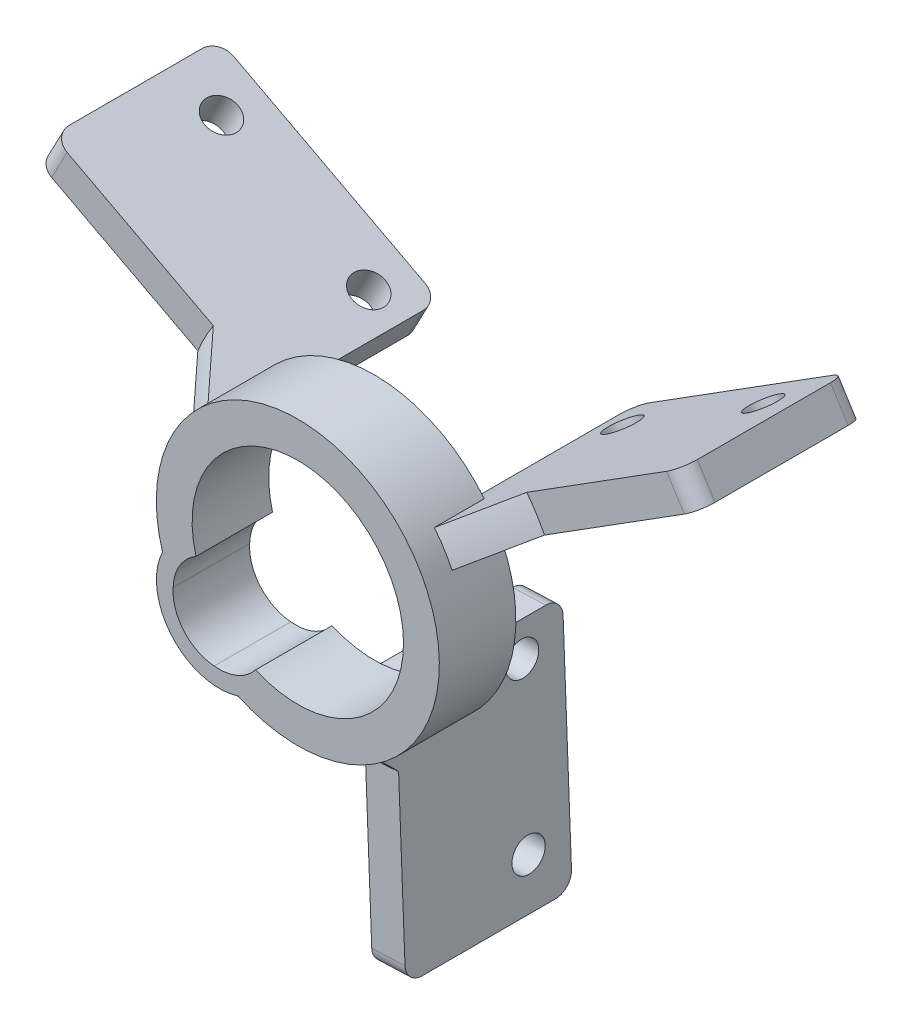
from build123d import *

# Parameters (mm, degrees)
CROQUIS1_R              = 8.5
SALIENTE_EXTRUIR1_DEPTH = 4.6
CROQUIS6_R              = 6.35
CORTAR_EXTRUIR1_DEPTH   = 13.870897405
CROQUIS13_R             = 2.775
CORTAR_EXTRUIR7_DEPTH   = 10
SALIENTE_EXTRUIR4_DEPTH = 4.6
SALIENTE_EXTRUIR6_DEPTH = 10
CHAFL_N1_SIZE           = 3
REDONDEO1_R             = 1
CROQUIS16_R             = 1
CORTAR_EXTRUIR8_DEPTH   = 5
CHAFL_N3_SIZE           = 3
REDONDEO3_R             = 1
CROQUIS19_R             = 1
CORTAR_EXTRUIR10_DEPTH  = 5
CROQUIS20_R             = 1
CORTAR_EXTRUIR11_DEPTH  = 5


with BuildPart() as part:
    # Croquis1 → Saliente-Extruir1 (new body)
    with BuildSketch(Plane.XY):
        Circle(CROQUIS1_R)
    extrude(amount=SALIENTE_EXTRUIR1_DEPTH)

    # Croquis6 → Cortar-Extruir1 (cut, through all)
    with BuildSketch(Plane.XY.offset(4.6)):
        Circle(CROQUIS6_R)
    extrude(amount=-CORTAR_EXTRUIR1_DEPTH, mode=Mode.SUBTRACT)

    # Croquis13 → Cortar-Extruir7 (cut)
    with BuildSketch(Plane(origin=(0, 0, 0), x_dir=(-1, 0, 0), z_dir=(0, 0, -1))):
        with Locations((4.716932975, -4.100371118)):
            Circle(CROQUIS13_R)
    extrude(amount=-CORTAR_EXTRUIR7_DEPTH, mode=Mode.SUBTRACT)

    # Croquis14 → Saliente-Extruir4 (add)
    with BuildSketch(Plane(origin=(0, 0, 0), x_dir=(-1, 0, 0), z_dir=(0, 0, -1))):
        with BuildLine():
            ThreePointArc((1.551676597, -6.157499471), (7.565960492, -6.576995274), (6.313526123, -0.679623346))
            ThreePointArc((6.313526123, -0.679623346), (6.23633763, -1.196073977), (6.11697615, -1.704436205))
            ThreePointArc((6.11697615, -1.704436205), (7.102852286, -2.683326996), (7.490692392, -4.017403077))
            ThreePointArc((7.490692392, -4.017403077), (6.844195938, -5.949574331), (5.020802515, -6.858683701))
            ThreePointArc((5.020802515, -6.858683701), (3.645732845, -6.660284257), (2.539161891, -5.820236841))
            ThreePointArc((2.539161891, -5.820236841), (2.052358742, -6.0091866), (1.551676597, -6.157499471))
        make_face()
    extrude(amount=-SALIENTE_EXTRUIR4_DEPTH)

    # Croquis15 → Saliente-Extruir6 (add)
    with BuildSketch(Plane(origin=(0, 0, 0), x_dir=(-1, 0, 0), z_dir=(0, 0, -1))):
        Polygon((6.067896868, 4.315078912), (7, 2.545563795), (20.271363381, 9.536337286), (19.339260249, 11.305852404), align=None)
        Polygon((0.121525269, -22.401216868), (0.703019524, -7.412492291), (-1.295477087, -7.334959724), (-1.876971341, -22.323684301), align=None)
        Polygon((-19.460785518, 11.095364464), (-6.770916391, 3.097413379), (-5.704522913, 4.789395929), (-18.39439204, 12.787347014), align=None)
    extrude(amount=SALIENTE_EXTRUIR6_DEPTH)

    # Chaflán1
    chafl_n1_edges = [part.edges().sort_by_distance(p)[0] for p in [
        (-7.525199261, 3.952388655, 0),
    ]]
    chamfer(chafl_n1_edges, length=CHAFL_N1_SIZE)

    # Redondeo1
    redondeo1_edges = [part.edges().sort_by_distance(p)[0] for p in [
        (-19.805311815, 10.421094845, 0),
        (-6.533948434, 3.430321354, -10),
        (-19.805311815, 10.421094845, -10),
    ]]
    fillet(redondeo1_edges, radius=REDONDEO1_R)

    # Croquis16 → Cortar-Extruir8 (cut)
    with BuildSketch(Plane(origin=(-0.470783925, -0.893741523, 0), x_dir=(-0.8847575587350184, 0.46605156609676857, 0), z_dir=(-0.4660515660967685, -0.8847575587350183, 0))):
        with Locations(Location((9.379666904, 7.5, 0), (0, 0, 180))):
            Circle(CROQUIS16_R)
        with Locations(Location((19.379666904, 7.5, 0), (0, 0, 180))):
            Circle(CROQUIS16_R)
    extrude(amount=-CORTAR_EXTRUIR8_DEPTH, mode=Mode.SUBTRACT)

    # Chaflán3
    chafl_n3_edges = [part.edges().sort_by_distance(p)[0] for p in [
        (0.339730649, -8.493208056, 0),
        (7.185468612, 4.540819401, 0),
    ]]
    chamfer(chafl_n3_edges, length=CHAFL_N3_SIZE)

    # Redondeo3
    redondeo3_edges = [part.edges().sort_by_distance(p)[0] for p in [
        (0.877723036, -22.362450584, 0),
        (0.296228781, -7.373726008, -10),
        (0.877723036, -22.362450584, -10),
        (18.927588779, 11.941355739, 0),
        (6.237719652, 3.943404654, -10),
        (18.927588779, 11.941355739, -10),
    ]]
    fillet(redondeo3_edges, radius=REDONDEO3_R)

    # Croquis19 → Cortar-Extruir10 (cut)
    with BuildSketch(Plane(origin=(-0.989101784, -0.038372645, 0), x_dir=(0, 0, 1), z_dir=(-0.9992483051032128, -0.038766283654184684, 0))):
        with Locations(Location((-7.5, -9.379666904, 0), (0, 0, 270))):
            Circle(CROQUIS19_R)
        with Locations(Location((-7.5, -19.379666904, 0), (0, 0, 270))):
            Circle(CROQUIS19_R)
    extrude(amount=-CORTAR_EXTRUIR10_DEPTH, mode=Mode.SUBTRACT)

    # Croquis20 → Cortar-Extruir11 (cut)
    with BuildSketch(Plane(origin=(0.527782577, -0.83740095, 0), x_dir=(0.8459912750808336, 0.5331967390064434, 0), z_dir=(0.5331967390064434, -0.8459912750808336, 0))):
        with Locations((9.379666904, -7.5)):
            Circle(CROQUIS20_R)
        with Locations((19.379666904, -7.5)):
            Circle(CROQUIS20_R)
    extrude(amount=-CORTAR_EXTRUIR11_DEPTH, mode=Mode.SUBTRACT)


solid = part.part
